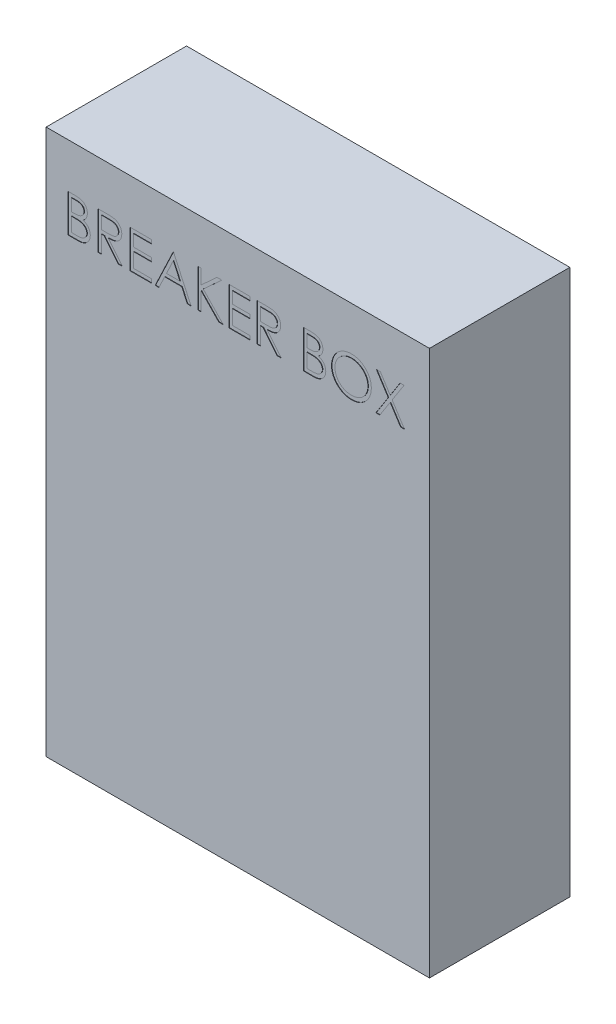
from build123d import *

# Parameters (mm, degrees)
SKETCH1_W           = 225.425
SKETCH1_H           = 320.675
BOSS_EXTRUDE1_DEPTH = 82.55
CUT_EXTRUDE1_DEPTH  = 0.254


with BuildPart() as part:
    # Sketch1 → Boss-Extrude1 (new body)
    with BuildSketch(Plane.XY):
        with Locations((112.7125, -160.3375)):
            Rectangle(SKETCH1_W, SKETCH1_H)
    extrude(amount=-BOSS_EXTRUDE1_DEPTH)

    # Sketch2 → Cut-Extrude1 (cut)
    # profile 1 of 10: a face of its own
    with BuildSketch(Plane.XY):
        with BuildLine():
            Line((12.849427249, -26.324185299), (17.185795438, -26.324185299))
            add(Edge.make_bspline(
                [(17.185795438, -26.324185299), (17.398066274, -26.325301314), (17.809499985, -26.327464429), (18.407793441, -26.361012311), (18.968173388, -26.406755615), (19.490802343, -26.479336703), (19.975438803, -26.566914488), (20.423543299, -26.67297102), (20.833690893, -26.800140017), (21.323356769, -27.002363903), (21.881652966, -27.302866022), (22.48616276, -27.746912411), (23.003079679, -28.290043552), (23.448762794, -28.902708413), (23.803099904, -29.576670564), (24.059444941, -30.295866413), (24.22173745, -31.051019474), (24.238428007, -31.569453654), (24.246863146, -31.831461941)],
                knots=[0, 0, 0, 0, 1.001505555, 1.941167018, 2.826882275, 3.653841531, 4.429895133, 5.150066043, 5.825578002, 6.45369114, 7.647487171, 8.808567382, 9.977351308, 11.170798116, 12.373658725, 13.556498008, 14.765093433, 16, 16, 16, 16], degree=3))
            add(Edge.make_bspline(
                [(24.246863146, -31.831461941), (24.239921209, -32.07690567), (24.226279648, -32.559225743), (24.095833126, -33.264673337), (23.891612882, -33.936193576), (23.607734549, -34.571335724), (23.238786874, -35.155749167), (22.80153655, -35.694148307), (22.273998854, -36.163737519), (21.87875428, -36.42626495), (21.677987946, -36.559616989)],
                knots=[0, 0, 0, 0, 1.044552857, 2.05264487, 3.044412934, 4.028983338, 5.005914585, 5.980388656, 6.974128949, 8, 8, 8, 8], degree=3))
            add(Edge.make_bspline(
                [(21.677987946, -36.559616989), (21.930466661, -36.656549733), (22.413520987, -36.842006083), (23.078277166, -37.169891279), (23.651014432, -37.52652068), (24.136136309, -37.915977928), (24.551030417, -38.335768877), (24.913316596, -38.792048852), (25.222443322, -39.290769965), (25.487320387, -39.826732414), (25.694004988, -40.394463488), (25.84879198, -40.988637917), (25.937485282, -41.607125092), (25.950106805, -42.028037251), (25.956478531, -42.240526444)],
                knots=[0, 0, 0, 0, 1.27268992, 2.434971085, 3.483601985, 4.442670788, 5.356604649, 6.2567628, 7.179492994, 8.113709626, 9.066344395, 10.018646069, 10.999752585, 12, 12, 12, 12], degree=3))
            add(Edge.make_bspline(
                [(25.956478531, -42.240526444), (25.950275559, -42.457486082), (25.938071037, -42.884360248), (25.848028216, -43.511455353), (25.695570387, -44.110736264), (25.485568607, -44.686079174), (25.211487909, -45.236371028), (24.877935336, -45.762235254), (24.480224907, -46.258388254), (24.035325689, -46.73034326), (23.532011065, -47.15469971), (22.988986021, -47.532624447), (22.39941189, -47.843431942), (21.772971728, -48.104518678), (21.102638321, -48.303954389), (20.391421764, -48.443480233), (19.639935447, -48.537492218), (19.124253528, -48.545221469), (18.859793835, -48.549185299)],
                knots=[0, 0, 0, 0, 0.978564426, 1.925352924, 2.850884081, 3.763762016, 4.682927383, 5.618979971, 6.567305752, 7.547517671, 8.540179244, 9.531824382, 10.526200242, 11.540722885, 12.589160233, 13.674978461, 14.80764778, 16, 16, 16, 16], degree=3))
            Line((18.859793835, -48.549185299), (12.849427249, -48.549185299))
            Line((12.849427249, -48.549185299), (12.849427249, -26.324185299))
        make_face()
        with BuildLine():
            Line((14.843978531, -28.603672478), (14.843978531, -35.727069914))
            Line((14.843978531, -35.727069914), (16.184067673, -35.727069914))
            add(Edge.make_bspline(
                [(16.184067673, -35.727069914), (16.379957524, -35.724530403), (16.758456635, -35.71962355), (17.306587978, -35.705567717), (17.815381844, -35.666210141), (18.283959984, -35.626863877), (18.711584503, -35.562890245), (19.097308024, -35.486740265), (19.447184114, -35.406203817), (19.850660228, -35.269237576), (20.308323451, -35.066814338), (20.796213663, -34.752668179), (21.226327544, -34.378498536), (21.589529686, -33.946755929), (21.886782524, -33.471355649), (22.093244616, -32.959882958), (22.23324487, -32.425085119), (22.245891094, -32.057939214), (22.252311864, -31.871531052)],
                knots=[0, 0, 0, 0, 1.156816544, 2.235205308, 3.236616184, 4.169592532, 5.011045266, 5.787822928, 6.49130361, 7.128639758, 8.301311294, 9.436451833, 10.541879658, 11.654887649, 12.756523258, 13.837046038, 14.901820046, 16, 16, 16, 16], degree=3))
            add(Edge.make_bspline(
                [(22.252311864, -31.871531052), (22.24897062, -31.748177403), (22.242416405, -31.50620575), (22.188737933, -31.153467351), (22.097503835, -30.821719523), (21.980319073, -30.506415922), (21.8165609, -30.217415673), (21.623752908, -29.94472638), (21.390798775, -29.697634428), (21.125639839, -29.466688114), (20.820785084, -29.261935362), (20.476416381, -29.082606516), (20.087874632, -28.938202584), (19.661708003, -28.811735016), (19.191356597, -28.72290935), (18.682248183, -28.648910338), (18.130212717, -28.611237427), (17.748291316, -28.606250372), (17.550869556, -28.603672478)],
                knots=[0, 0, 0, 0, 0.91205012, 1.789085906, 2.630437955, 3.453916878, 4.269457761, 5.079663411, 5.91843418, 6.774407191, 7.675494373, 8.627863946, 9.638891023, 10.736472738, 11.911756761, 13.175263542, 14.539845004, 16, 16, 16, 16], degree=3))
            Line((17.550869556, -28.603672478), (14.843978531, -28.603672478))
        make_face(mode=Mode.SUBTRACT)
        with BuildLine():
            Line((14.843978531, -38.006557094), (14.843978531, -46.269698119))
            Line((14.843978531, -46.269698119), (17.684433258, -46.269698119))
            add(Edge.make_bspline(
                [(17.684433258, -46.269698119), (17.887753438, -46.267261323), (18.27962628, -46.26256472), (18.845419091, -46.247232299), (19.3698218, -46.212356348), (19.850441462, -46.157455203), (20.292467836, -46.09790205), (20.690598251, -46.017820417), (21.048060029, -45.926069517), (21.462551883, -45.784247524), (21.929299161, -45.563924933), (22.432288099, -45.231729595), (22.879494584, -44.835976591), (23.25925798, -44.377945286), (23.570490457, -43.87990636), (23.796902597, -43.351933388), (23.936544537, -42.802750289), (23.953449312, -42.428311664), (23.961927249, -42.240526444)],
                knots=[0, 0, 0, 0, 1.160039823, 2.235823828, 3.228722157, 4.157150951, 4.99529583, 5.772374946, 6.472645482, 7.099169577, 8.269452708, 9.405989375, 10.527446681, 11.663510218, 12.788923519, 13.866172445, 14.929861265, 16, 16, 16, 16], degree=3))
            add(Edge.make_bspline(
                [(23.961927249, -42.240526444), (23.960173986, -42.123093732), (23.956695741, -41.890122508), (23.904240837, -41.547757056), (23.827952763, -41.216122761), (23.729328158, -40.894319108), (23.585694542, -40.588164169), (23.418012981, -40.291602916), (23.221408081, -40.004243321), (22.915057628, -39.640945512), (22.469465526, -39.22237248), (21.836327502, -38.81255934), (21.11641341, -38.482055765), (20.59426883, -38.341724091), (20.324542433, -38.269232374)],
                knots=[0, 0, 0, 0, 0.723448775, 1.435228256, 2.130040452, 2.821711965, 3.505591119, 4.210454504, 4.921174351, 5.648778258, 7.137944449, 8.670945889, 10.280296675, 12, 12, 12, 12], degree=3))
            add(Edge.make_bspline(
                [(20.324542433, -38.269232374), (20.216407674, -38.247292591), (19.981949213, -38.199722616), (19.599631077, -38.149508699), (19.16315831, -38.104772569), (18.671523039, -38.071681718), (18.124103248, -38.037477166), (17.519729815, -38.024175052), (16.860870867, -38.00830475), (16.403719302, -38.007154548), (16.16625918, -38.006557094)],
                knots=[0, 0, 0, 0, 0.634451884, 1.375622551, 2.216452059, 3.157844607, 4.20941857, 5.370758133, 6.634282058, 8, 8, 8, 8], degree=3))
            Line((16.16625918, -38.006557094), (14.843978531, -38.006557094))
        make_face(mode=Mode.SUBTRACT)
    # profile 2 of 10: a face of its own
    with BuildSketch(Plane.XY):
        with BuildLine():
            Line((30.51545289, -26.324185299), (34.963124164, -26.324185299))
            add(Edge.make_bspline(
                [(34.963124164, -26.324185299), (35.25993033, -26.32517327), (35.829831047, -26.327070283), (36.646271314, -26.337647878), (37.38812338, -26.367965037), (38.054999359, -26.394054542), (38.646887018, -26.441628369), (39.165601315, -26.487098478), (39.608753194, -26.546621224), (39.87701435, -26.60190066), (39.998475726, -26.62692969)],
                knots=[0, 0, 0, 0, 1.410062039, 2.707475311, 3.878576406, 4.937260626, 5.877586885, 6.699081471, 7.410979367, 8, 8, 8, 8], degree=3))
            add(Edge.make_bspline(
                [(39.998475726, -26.62692969), (40.16107779, -26.66710465), (40.482813173, -26.746597529), (40.946046092, -26.914615994), (41.387462049, -27.109050611), (41.805227434, -27.337420235), (42.197249708, -27.601420085), (42.567570981, -27.896492663), (42.917871674, -28.22102342), (43.233985025, -28.583194663), (43.532048004, -28.9631565), (43.783435782, -29.374025356), (44.000138928, -29.803676055), (44.172671711, -30.256478158), (44.311596843, -30.728040409), (44.409553463, -31.222634269), (44.468298504, -31.73800646), (44.474279287, -32.089529181), (44.477311864, -32.267770034)],
                knots=[0, 0, 0, 0, 1.027469482, 2.033020251, 3.019912614, 3.986113645, 4.951240523, 5.91722682, 6.890402269, 7.87763091, 8.8651537, 9.85103654, 10.82876324, 11.815024772, 12.821070561, 13.842952187, 14.906261191, 16, 16, 16, 16], degree=3))
            add(Edge.make_bspline(
                [(44.477311864, -32.267770034), (44.467983726, -32.563902948), (44.449782113, -33.141734965), (44.280077705, -33.980321562), (44.002096804, -34.762573709), (43.619043919, -35.48750646), (43.131240248, -36.140989058), (42.544977825, -36.714968449), (41.859929592, -37.195281894), (41.222203436, -37.528357204), (40.658868267, -37.741672174), (40.195106731, -37.891763053), (39.689221424, -38.007726532), (39.146059349, -38.111613369), (38.563360137, -38.190046629), (37.942520387, -38.247492503), (37.283097324, -38.283395713), (36.830094234, -38.288742444), (36.597053451, -38.291492991)],
                knots=[0, 0, 0, 0, 1.260483769, 2.459530307, 3.627416485, 4.787058657, 5.939039949, 7.08810263, 8.267026773, 9.491475466, 10.141966685, 10.831826277, 11.566392101, 12.351337768, 13.187381173, 14.07005841, 15.007169909, 16, 16, 16, 16], degree=3))
            Line((36.597053451, -38.291492991), (44.762247762, -48.549185299))
            Line((44.762247762, -48.549185299), (42.295771399, -48.549185299))
            Line((42.295771399, -48.549185299), (34.130577088, -38.291492991))
            Line((34.130577088, -38.291492991), (32.510004172, -38.291492991))
            Line((32.510004172, -38.291492991), (32.510004172, -48.549185299))
            Line((32.510004172, -48.549185299), (30.51545289, -48.549185299))
            Line((30.51545289, -48.549185299), (30.51545289, -26.324185299))
        make_face()
        with BuildLine():
            Line((32.510004172, -28.603672478), (32.510004172, -36.012005811))
            Line((32.510004172, -36.012005811), (36.579244957, -36.043170675))
            add(Edge.make_bspline(
                [(36.579244957, -36.043170675), (36.769237204, -36.043254728), (37.137496292, -36.043417646), (37.670265513, -36.018057167), (38.166328223, -35.989207096), (38.623786999, -35.945078752), (39.042846202, -35.888207697), (39.423296376, -35.817068747), (39.765758556, -35.734188149), (40.165164275, -35.605907825), (40.611166249, -35.402669609), (41.095871019, -35.106978692), (41.508635864, -34.735064786), (41.857364289, -34.30978334), (42.137586179, -33.84219316), (42.335147724, -33.337899215), (42.460512233, -32.809632568), (42.475298497, -32.446551583), (42.482760582, -32.263317911)],
                knots=[0, 0, 0, 0, 1.146690395, 2.22261258, 3.21895312, 4.145990853, 4.996080663, 5.770904154, 6.481378293, 7.121626537, 8.300444488, 9.431385265, 10.535395872, 11.636531494, 12.74115979, 13.810798291, 14.895190096, 16, 16, 16, 16], degree=3))
            add(Edge.make_bspline(
                [(42.482760582, -32.263317911), (42.475127113, -32.084587168), (42.460000363, -31.730408052), (42.336500683, -31.211893022), (42.127653111, -30.722517888), (41.846206901, -30.264273409), (41.503312267, -29.848311986), (41.101244156, -29.492412564), (40.650996167, -29.198728463), (40.230174057, -29.011058147), (39.854036808, -28.895997079), (39.527458467, -28.815027189), (39.158450583, -28.749974811), (38.745221421, -28.697853625), (38.289535065, -28.653054729), (37.789087431, -28.622880934), (37.247198876, -28.605012897), (36.871615863, -28.604129683), (36.677191672, -28.603672478)],
                knots=[0, 0, 0, 0, 1.101028733, 2.181837193, 3.264309656, 4.369019818, 5.486613113, 6.575447106, 7.666700264, 8.788928104, 9.402425223, 10.0903467, 10.862060571, 11.710948788, 12.657782767, 13.684531032, 14.801375019, 16, 16, 16, 16], degree=3))
            Line((36.677191672, -28.603672478), (32.510004172, -28.603672478))
        make_face(mode=Mode.SUBTRACT)
    # profile 3 of 10: a face of its own
    with BuildSketch(Plane.XY):
        Polygon((49.321222121, -26.324185299), (61.858401608, -26.324185299), (61.858401608, -28.603672478), (51.315773403, -28.603672478), (51.315773403, -35.442134017), (61.858401608, -35.442134017), (61.858401608, -37.721621196), (51.315773403, -37.721621196), (51.315773403, -46.269698119), (61.858401608, -46.269698119), (61.858401608, -48.549185299), (49.321222121, -48.549185299), align=None)
    # profile 4 of 10: a face of its own
    with BuildSketch(Plane.XY):
        Polygon((74.96545289, -26.324185299), (85.223145197, -48.549185299), (83.054961103, -48.549185299), (79.769294036, -41.425787863), (69.694138787, -41.425787863), (66.314977129, -48.549185299), (64.137888787, -48.549185299), (74.680516992, -26.324185299), align=None)
        Polygon((74.800724324, -30.656101364), (70.776004773, -39.146300683), (78.718592914, -39.146300683), align=None, mode=Mode.SUBTRACT)
    # profile 5 of 10: a face of its own
    with BuildSketch(Plane.XY):
        Polygon((89.212247762, -26.324185299), (91.206799044, -26.324185299), (91.206799044, -34.787671877), (100.471667834, -26.324185299), (103.316574685, -26.324185299), (92.395515991, -36.296941709), (104.171382377, -48.549185299), (101.513464709, -48.549185299), (91.206799044, -37.824020034), (91.206799044, -48.549185299), (89.212247762, -48.549185299), align=None)
    # profile 6 of 10: a face of its own
    with BuildSketch(Plane.XY):
        Polygon((107.448145197, -26.324185299), (119.985324685, -26.324185299), (119.985324685, -28.603672478), (109.44269648, -28.603672478), (109.44269648, -35.442134017), (119.985324685, -35.442134017), (119.985324685, -37.721621196), (109.44269648, -37.721621196), (109.44269648, -46.269698119), (119.985324685, -46.269698119), (119.985324685, -48.549185299), (107.448145197, -48.549185299), align=None)
    # profile 7 of 10: a face of its own
    with BuildSketch(Plane.XY):
        with BuildLine():
            Line((123.974427249, -26.324185299), (128.422098523, -26.324185299))
            add(Edge.make_bspline(
                [(128.422098523, -26.324185299), (128.718904689, -26.32517327), (129.288805406, -26.327070283), (130.105245673, -26.337647878), (130.847097739, -26.367965037), (131.513973718, -26.394054542), (132.105861377, -26.441628369), (132.624575674, -26.487098478), (133.067727553, -26.546621224), (133.335988709, -26.60190066), (133.457450085, -26.62692969)],
                knots=[0, 0, 0, 0, 1.410062039, 2.707475311, 3.878576406, 4.937260626, 5.877586885, 6.699081471, 7.410979367, 8, 8, 8, 8], degree=3))
            add(Edge.make_bspline(
                [(133.457450085, -26.62692969), (133.620052149, -26.66710465), (133.941787532, -26.746597529), (134.405020451, -26.914615994), (134.846436408, -27.109050611), (135.264201793, -27.337420235), (135.656224067, -27.601420085), (136.02654534, -27.896492663), (136.376846033, -28.22102342), (136.692959384, -28.583194663), (136.991022363, -28.9631565), (137.242410141, -29.374025356), (137.459113287, -29.803676055), (137.63164607, -30.256478158), (137.770571202, -30.728040409), (137.868527822, -31.222634269), (137.927272863, -31.73800646), (137.933253646, -32.089529181), (137.936286223, -32.267770034)],
                knots=[0, 0, 0, 0, 1.027469482, 2.033020251, 3.019912614, 3.986113645, 4.951240523, 5.91722682, 6.890402269, 7.87763091, 8.8651537, 9.85103654, 10.82876324, 11.815024772, 12.821070561, 13.842952187, 14.906261191, 16, 16, 16, 16], degree=3))
            add(Edge.make_bspline(
                [(137.936286223, -32.267770034), (137.926958085, -32.563902948), (137.908756472, -33.141734965), (137.739052063, -33.980321562), (137.461071163, -34.762573709), (137.078018278, -35.48750646), (136.590214607, -36.140989058), (136.003952184, -36.714968449), (135.318903951, -37.195281894), (134.681177795, -37.528357204), (134.117842626, -37.741672174), (133.65408109, -37.891763053), (133.148195783, -38.007726532), (132.605033708, -38.111613369), (132.022334496, -38.190046629), (131.401494746, -38.247492503), (130.742071683, -38.283395713), (130.289068593, -38.288742444), (130.05602781, -38.291492991)],
                knots=[0, 0, 0, 0, 1.260483769, 2.459530307, 3.627416485, 4.787058657, 5.939039949, 7.08810263, 8.267026773, 9.491475466, 10.141966685, 10.831826277, 11.566392101, 12.351337768, 13.187381173, 14.07005841, 15.007169909, 16, 16, 16, 16], degree=3))
            Line((130.05602781, -38.291492991), (138.221222121, -48.549185299))
            Line((138.221222121, -48.549185299), (135.754745758, -48.549185299))
            Line((135.754745758, -48.549185299), (127.589551447, -38.291492991))
            Line((127.589551447, -38.291492991), (125.968978531, -38.291492991))
            Line((125.968978531, -38.291492991), (125.968978531, -48.549185299))
            Line((125.968978531, -48.549185299), (123.974427249, -48.549185299))
            Line((123.974427249, -48.549185299), (123.974427249, -26.324185299))
        make_face()
        with BuildLine():
            Line((125.968978531, -28.603672478), (125.968978531, -36.012005811))
            Line((125.968978531, -36.012005811), (130.038219316, -36.043170675))
            add(Edge.make_bspline(
                [(130.038219316, -36.043170675), (130.228211563, -36.043254728), (130.596470651, -36.043417646), (131.129239872, -36.018057167), (131.625302582, -35.989207096), (132.082761358, -35.945078752), (132.501820561, -35.888207697), (132.882270735, -35.817068747), (133.224732915, -35.734188149), (133.624138634, -35.605907825), (134.070140608, -35.402669609), (134.554845378, -35.106978692), (134.967610223, -34.735064786), (135.316338648, -34.30978334), (135.596560538, -33.84219316), (135.794122083, -33.337899215), (135.919486592, -32.809632568), (135.934272855, -32.446551583), (135.941734941, -32.263317911)],
                knots=[0, 0, 0, 0, 1.146690395, 2.22261258, 3.21895312, 4.145990853, 4.996080663, 5.770904154, 6.481378293, 7.121626537, 8.300444488, 9.431385265, 10.535395872, 11.636531494, 12.74115979, 13.810798291, 14.895190096, 16, 16, 16, 16], degree=3))
            add(Edge.make_bspline(
                [(135.941734941, -32.263317911), (135.934101472, -32.084587168), (135.918974722, -31.730408052), (135.795475042, -31.211893022), (135.58662747, -30.722517888), (135.30518126, -30.264273409), (134.962286626, -29.848311986), (134.560218515, -29.492412564), (134.109970526, -29.198728463), (133.689148416, -29.011058147), (133.313011167, -28.895997079), (132.986432826, -28.815027189), (132.617424942, -28.749974811), (132.20419578, -28.697853625), (131.748509424, -28.653054729), (131.24806179, -28.622880934), (130.706173235, -28.605012897), (130.330590222, -28.604129683), (130.136166031, -28.603672478)],
                knots=[0, 0, 0, 0, 1.101028733, 2.181837193, 3.264309656, 4.369019818, 5.486613113, 6.575447106, 7.666700264, 8.788928104, 9.402425223, 10.0903467, 10.862060571, 11.710948788, 12.657782767, 13.684531032, 14.801375019, 16, 16, 16, 16], degree=3))
            Line((130.136166031, -28.603672478), (125.968978531, -28.603672478))
        make_face(mode=Mode.SUBTRACT)
    # profile 8 of 10: a face of its own
    with BuildSketch(Plane.XY):
        with BuildLine():
            Line((151.328273403, -26.324185299), (155.664641592, -26.324185299))
            add(Edge.make_bspline(
                [(155.664641592, -26.324185299), (155.876912428, -26.325301314), (156.288346139, -26.327464429), (156.886639594, -26.361012311), (157.447019542, -26.406755615), (157.969648496, -26.479336703), (158.454284957, -26.566914488), (158.902389453, -26.67297102), (159.312537047, -26.800140017), (159.802202923, -27.002363903), (160.36049912, -27.302866022), (160.965008913, -27.746912411), (161.481925833, -28.290043552), (161.927608948, -28.902708413), (162.281946057, -29.576670564), (162.538291095, -30.295866413), (162.700583604, -31.051019474), (162.717274161, -31.569453654), (162.7257093, -31.831461941)],
                knots=[0, 0, 0, 0, 1.001505555, 1.941167018, 2.826882275, 3.653841531, 4.429895133, 5.150066043, 5.825578002, 6.45369114, 7.647487171, 8.808567382, 9.977351308, 11.170798116, 12.373658725, 13.556498008, 14.765093433, 16, 16, 16, 16], degree=3))
            add(Edge.make_bspline(
                [(162.7257093, -31.831461941), (162.718767363, -32.07690567), (162.705125802, -32.559225743), (162.57467928, -33.264673337), (162.370459035, -33.936193576), (162.086580703, -34.571335724), (161.717633027, -35.155749167), (161.280382704, -35.694148307), (160.752845008, -36.163737519), (160.357600434, -36.42626495), (160.1568341, -36.559616989)],
                knots=[0, 0, 0, 0, 1.044552857, 2.05264487, 3.044412934, 4.028983338, 5.005914585, 5.980388656, 6.974128949, 8, 8, 8, 8], degree=3))
            add(Edge.make_bspline(
                [(160.1568341, -36.559616989), (160.409312815, -36.656549733), (160.892367141, -36.842006083), (161.55712332, -37.169891279), (162.129860585, -37.52652068), (162.614982462, -37.915977928), (163.029876571, -38.335768877), (163.39216275, -38.792048852), (163.701289476, -39.290769965), (163.966166541, -39.826732414), (164.172851142, -40.394463488), (164.327638134, -40.988637917), (164.416331436, -41.607125092), (164.428952958, -42.028037251), (164.435324685, -42.240526444)],
                knots=[0, 0, 0, 0, 1.27268992, 2.434971085, 3.483601985, 4.442670788, 5.356604649, 6.2567628, 7.179492994, 8.113709626, 9.066344395, 10.018646069, 10.999752585, 12, 12, 12, 12], degree=3))
            add(Edge.make_bspline(
                [(164.435324685, -42.240526444), (164.429121712, -42.457486082), (164.416917191, -42.884360248), (164.32687437, -43.511455353), (164.17441654, -44.110736264), (163.964414761, -44.686079174), (163.690334063, -45.236371028), (163.35678149, -45.762235254), (162.959071061, -46.258388254), (162.514171843, -46.73034326), (162.010857219, -47.15469971), (161.467832175, -47.532624447), (160.878258044, -47.843431942), (160.251817882, -48.104518678), (159.581484475, -48.303954389), (158.870267918, -48.443480233), (158.118781601, -48.537492218), (157.603099682, -48.545221469), (157.338639989, -48.549185299)],
                knots=[0, 0, 0, 0, 0.978564426, 1.925352924, 2.850884081, 3.763762016, 4.682927383, 5.618979971, 6.567305752, 7.547517671, 8.540179244, 9.531824382, 10.526200242, 11.540722885, 12.589160233, 13.674978461, 14.80764778, 16, 16, 16, 16], degree=3))
            Line((157.338639989, -48.549185299), (151.328273403, -48.549185299))
            Line((151.328273403, -48.549185299), (151.328273403, -26.324185299))
        make_face()
        with BuildLine():
            Line((153.322824685, -28.603672478), (153.322824685, -35.727069914))
            Line((153.322824685, -35.727069914), (154.662913827, -35.727069914))
            add(Edge.make_bspline(
                [(154.662913827, -35.727069914), (154.858803678, -35.724530403), (155.237302789, -35.71962355), (155.785434132, -35.705567717), (156.294227998, -35.666210141), (156.762806138, -35.626863877), (157.190430657, -35.562890245), (157.576154178, -35.486740265), (157.926030268, -35.406203817), (158.329506382, -35.269237576), (158.787169605, -35.066814338), (159.275059816, -34.752668179), (159.705173698, -34.378498536), (160.06837584, -33.946755929), (160.365628678, -33.471355649), (160.572090769, -32.959882958), (160.712091024, -32.425085119), (160.724737248, -32.057939214), (160.731158018, -31.871531052)],
                knots=[0, 0, 0, 0, 1.156816544, 2.235205308, 3.236616184, 4.169592532, 5.011045266, 5.787822928, 6.49130361, 7.128639758, 8.301311294, 9.436451833, 10.541879658, 11.654887649, 12.756523258, 13.837046038, 14.901820046, 16, 16, 16, 16], degree=3))
            add(Edge.make_bspline(
                [(160.731158018, -31.871531052), (160.727816774, -31.748177403), (160.721262559, -31.50620575), (160.667584087, -31.153467351), (160.576349989, -30.821719523), (160.459165227, -30.506415922), (160.295407054, -30.217415673), (160.102599062, -29.94472638), (159.869644929, -29.697634428), (159.604485993, -29.466688114), (159.299631238, -29.261935362), (158.955262535, -29.082606516), (158.566720786, -28.938202584), (158.140554157, -28.811735016), (157.670202751, -28.72290935), (157.161094337, -28.648910338), (156.609058871, -28.611237427), (156.22713747, -28.606250372), (156.02971571, -28.603672478)],
                knots=[0, 0, 0, 0, 0.91205012, 1.789085906, 2.630437955, 3.453916878, 4.269457761, 5.079663411, 5.91843418, 6.774407191, 7.675494373, 8.627863946, 9.638891023, 10.736472738, 11.911756761, 13.175263542, 14.539845004, 16, 16, 16, 16], degree=3))
            Line((156.02971571, -28.603672478), (153.322824685, -28.603672478))
        make_face(mode=Mode.SUBTRACT)
        with BuildLine():
            Line((153.322824685, -38.006557094), (153.322824685, -46.269698119))
            Line((153.322824685, -46.269698119), (156.163279412, -46.269698119))
            add(Edge.make_bspline(
                [(156.163279412, -46.269698119), (156.366599592, -46.267261323), (156.758472434, -46.26256472), (157.324265245, -46.247232299), (157.848667954, -46.212356348), (158.329287616, -46.157455203), (158.77131399, -46.09790205), (159.169444404, -46.017820417), (159.526906183, -45.926069517), (159.941398037, -45.784247524), (160.408145315, -45.563924933), (160.911134253, -45.231729595), (161.358340738, -44.835976591), (161.738104134, -44.377945286), (162.049336611, -43.87990636), (162.275748751, -43.351933388), (162.415390691, -42.802750289), (162.432295466, -42.428311664), (162.440773403, -42.240526444)],
                knots=[0, 0, 0, 0, 1.160039823, 2.235823828, 3.228722157, 4.157150951, 4.99529583, 5.772374946, 6.472645482, 7.099169577, 8.269452708, 9.405989375, 10.527446681, 11.663510218, 12.788923519, 13.866172445, 14.929861265, 16, 16, 16, 16], degree=3))
            add(Edge.make_bspline(
                [(162.440773403, -42.240526444), (162.43902014, -42.123093732), (162.435541895, -41.890122508), (162.38308699, -41.547757056), (162.306798917, -41.216122761), (162.208174312, -40.894319108), (162.064540696, -40.588164169), (161.896859135, -40.291602916), (161.700254235, -40.004243321), (161.393903782, -39.640945512), (160.94831168, -39.22237248), (160.315173656, -38.81255934), (159.595259564, -38.482055765), (159.073114984, -38.341724091), (158.803388587, -38.269232374)],
                knots=[0, 0, 0, 0, 0.723448775, 1.435228256, 2.130040452, 2.821711965, 3.505591119, 4.210454504, 4.921174351, 5.648778258, 7.137944449, 8.670945889, 10.280296675, 12, 12, 12, 12], degree=3))
            add(Edge.make_bspline(
                [(158.803388587, -38.269232374), (158.695253828, -38.247292591), (158.460795367, -38.199722616), (158.078477231, -38.149508699), (157.642004464, -38.104772569), (157.150369193, -38.071681718), (156.602949402, -38.037477166), (155.998575968, -38.024175052), (155.33971702, -38.00830475), (154.882565456, -38.007154548), (154.645105334, -38.006557094)],
                knots=[0, 0, 0, 0, 0.634451884, 1.375622551, 2.216452059, 3.157844607, 4.20941857, 5.370758133, 6.634282058, 8, 8, 8, 8], degree=3))
            Line((154.645105334, -38.006557094), (153.322824685, -38.006557094))
        make_face(mode=Mode.SUBTRACT)
    # profile 9 of 10: a face of its own
    with BuildSketch(Plane.XY):
        with BuildLine():
            add(Edge.make_bspline(
                [(179.3944593, -25.754313504), (179.805990773, -25.764736898), (180.614272538, -25.785209304), (181.802198138, -25.941921611), (182.936276993, -26.213037337), (184.025747375, -26.574117276), (185.057577776, -27.055792623), (186.039534743, -27.637993315), (186.969281892, -28.326818828), (187.834287665, -29.116944419), (188.625859299, -29.976629351), (189.323253677, -30.89406408), (189.907722242, -31.863701475), (190.387691991, -32.882627749), (190.764238162, -33.948538546), (191.02407409, -35.067116463), (191.190051343, -36.231113945), (191.20945553, -37.025034536), (191.219299044, -37.427781052)],
                knots=[0, 0, 0, 0, 1.065120563, 2.091984664, 3.0946048, 4.079830382, 5.057816894, 6.036188127, 7.030412546, 8.04752943, 9.064399622, 10.05169764, 11.02544977, 11.989514704, 12.962713494, 13.945757189, 14.957906945, 16, 16, 16, 16], degree=3))
            add(Edge.make_bspline(
                [(191.219299044, -37.427781052), (191.209456972, -37.827560836), (191.190057109, -38.615573106), (191.023885372, -39.772183976), (190.763275022, -40.884009899), (190.391188731, -41.949194794), (189.913506943, -42.968862324), (189.325146607, -43.940329481), (188.632099918, -44.863914746), (187.843386414, -45.72950017), (186.983589797, -46.523234109), (186.061377603, -47.21486897), (185.097490022, -47.810017161), (184.079523375, -48.284893491), (183.020978141, -48.664445185), (181.912380389, -48.923224386), (180.758924771, -49.090147111), (179.972343897, -49.109314687), (179.572544236, -49.119057094)],
                knots=[0, 0, 0, 0, 1.043624062, 2.057103931, 3.04512605, 4.022047818, 4.998200453, 5.980619268, 6.982898556, 8.009068085, 9.034988726, 10.034168286, 11.015286542, 11.987931943, 12.962482838, 13.94673481, 14.956375938, 16, 16, 16, 16], degree=3))
            add(Edge.make_bspline(
                [(179.572544236, -49.119057094), (179.16979981, -49.109218487), (178.375883339, -49.089823975), (177.210423165, -48.923572054), (176.091059491, -48.663594775), (175.020993361, -48.292059855), (173.999628058, -47.81189044), (173.024966033, -47.226392633), (172.100919448, -46.531657286), (171.235149358, -45.743199538), (170.442991949, -44.884860182), (169.752369914, -43.965162663), (169.166740444, -43.002150513), (168.688183283, -41.993151235), (168.309313966, -40.943042574), (168.050838371, -39.844819742), (167.883605075, -38.70474388), (167.8643338, -37.928501475), (167.854555454, -37.534632013)],
                knots=[0, 0, 0, 0, 1.053102029, 2.075944431, 3.073151272, 4.055350789, 5.033113405, 6.020478099, 7.024410459, 8.052272461, 9.079885166, 10.07527673, 11.055994387, 12.023226415, 12.992069828, 13.970394897, 14.97016774, 16, 16, 16, 16], degree=3))
            add(Edge.make_bspline(
                [(167.854555454, -37.534632013), (167.857950389, -37.270264564), (167.864697432, -36.74486478), (167.945924679, -35.964661869), (168.063791481, -35.197006192), (168.232713626, -34.444080673), (168.453640712, -33.70772842), (168.714321085, -32.982871076), (169.032709103, -32.27685443), (169.392631219, -31.586333893), (169.794343699, -30.922073691), (170.238054708, -30.294188338), (170.708179298, -29.697409008), (171.223566848, -29.147200534), (171.767231275, -28.627556816), (172.347991976, -28.146463563), (172.962305228, -27.699582624), (173.612814339, -27.296863458), (174.283490385, -26.932632953), (174.974857924, -26.6200742), (175.677527153, -26.351811709), (176.394789167, -26.134382469), (177.12473927, -25.96272904), (177.868970602, -25.845842344), (178.626890259, -25.764407926), (179.137502134, -25.757692788), (179.3944593, -25.754313504)],
                knots=[0, 0, 0, 0, 1.037015668, 2.060948919, 3.074880161, 4.083647147, 5.086022904, 6.090072063, 7.104153813, 8.122640571, 9.144368836, 10.147691507, 11.138137339, 12.123020368, 13.103399296, 14.087645067, 15.080126199, 16.082011238, 17.087798457, 18.072939717, 19.057185487, 20.037253025, 21.01195951, 21.997135196, 22.992090687, 24, 24, 24, 24], degree=3))
        make_face()
        with BuildLine():
            add(Edge.make_bspline(
                [(179.492406015, -28.033800683), (179.281493092, -28.036371736), (178.861683588, -28.041489263), (178.237576782, -28.108899057), (177.621678003, -28.204973852), (177.013860053, -28.342016509), (176.416666115, -28.528732244), (175.824529624, -28.743622011), (175.242850232, -29.005375936), (174.673548234, -29.301112609), (174.121637507, -29.628448256), (173.600856853, -29.990218977), (173.109858064, -30.377940796), (172.649843321, -30.792518564), (172.222163377, -31.236063535), (171.818400523, -31.701851504), (171.45473868, -32.203196012), (171.121455267, -32.726502096), (170.823209481, -33.271088137), (170.557999478, -33.831220762), (170.341058023, -34.411469073), (170.164131933, -35.005537974), (170.017448134, -35.612486593), (169.924522716, -36.236919233), (169.856372234, -36.875698194), (169.851547215, -37.307382967), (169.849106736, -37.525727767)],
                knots=[0, 0, 0, 0, 1.008559885, 2.007477868, 2.99961109, 3.989939068, 4.984837346, 5.991145699, 7.001802488, 8.033829008, 9.059044045, 10.069351652, 11.065060232, 12.050310815, 13.029377138, 14.011219647, 14.996725999, 15.989392538, 16.977580475, 17.965360261, 18.951710183, 19.937753436, 20.929683414, 21.935841486, 22.955955122, 24, 24, 24, 24], degree=3))
            add(Edge.make_bspline(
                [(169.849106736, -37.525727767), (169.857202109, -37.846797869), (169.873128213, -38.478442086), (170.012558784, -39.4040698), (170.227328321, -40.293630418), (170.543922598, -41.142256542), (170.939849001, -41.957242738), (171.428969754, -42.731359203), (172.008464948, -43.464815155), (172.666728342, -44.152490113), (173.386327529, -44.78016097), (174.150440364, -45.331108615), (174.950880771, -45.797263701), (175.789736108, -46.177025911), (176.662527981, -46.477950746), (177.57488043, -46.684190053), (178.520715849, -46.819924195), (179.165435509, -46.832959195), (179.492406015, -46.839569914)],
                knots=[0, 0, 0, 0, 1.032063989, 2.030389145, 3.003944642, 3.970395727, 4.937377036, 5.913328081, 6.909231446, 7.93887556, 8.970685674, 9.976071282, 10.964166581, 11.944589148, 12.933237628, 13.927779006, 14.949070134, 16, 16, 16, 16], degree=3))
            add(Edge.make_bspline(
                [(179.492406015, -46.839569914), (179.71217635, -46.836550461), (180.148046931, -46.83056198), (180.796353498, -46.770245382), (181.432980442, -46.673523011), (182.05703482, -46.534263348), (182.667808372, -46.359973587), (183.267850372, -46.152914514), (183.850769515, -45.894588871), (184.423919485, -45.609169379), (184.97253562, -45.283794378), (185.49625525, -44.934302128), (185.981877722, -44.547151386), (186.441548326, -44.138733277), (186.870984151, -43.700812843), (187.267281201, -43.233959434), (187.62910504, -42.735226261), (187.962261896, -42.212713934), (188.259462614, -41.66663773), (188.518409893, -41.104474275), (188.738095229, -40.52760783), (188.915441234, -39.935206351), (189.054413916, -39.328394962), (189.150171408, -38.706361165), (189.217153993, -38.07034934), (189.222202733, -37.640175855), (189.224747762, -37.423328928)],
                knots=[0, 0, 0, 0, 1.047197238, 2.076906641, 3.100256066, 4.114471768, 5.12198147, 6.126382909, 7.136867548, 8.15857795, 9.17633901, 10.174870724, 11.156907918, 12.133735059, 13.104061851, 14.077631395, 15.04955518, 16.038496417, 17.029181396, 18.010275684, 18.986308667, 19.968651475, 20.955262928, 21.950658345, 22.966943676, 24, 24, 24, 24], degree=3))
            add(Edge.make_bspline(
                [(189.224747762, -37.423328928), (189.222200694, -37.207965476), (189.217148117, -36.780752398), (189.150203403, -36.149176201), (189.054312749, -35.531618308), (188.916119553, -34.930503159), (188.738001077, -34.345677525), (188.518371529, -33.777690677), (188.259384877, -33.224426638), (187.962152652, -32.687252852), (187.628042173, -32.171793266), (187.262953728, -31.679017947), (186.860583768, -31.218181039), (186.43242851, -30.777905732), (185.967793388, -30.367582133), (185.46878312, -29.987074127), (184.941455767, -29.627198835), (184.383117822, -29.302551518), (183.806893715, -29.00274114), (183.215620082, -28.74587727), (182.6159953, -28.527614312), (182.009544186, -28.341451584), (181.391162274, -28.205510592), (180.765027961, -28.108812476), (180.132007519, -28.041512725), (179.706283074, -28.036379522), (179.492406015, -28.033800683)],
                knots=[0, 0, 0, 0, 1.02996197, 2.043119294, 3.035359645, 4.018872909, 4.991431989, 5.957985074, 6.929999688, 7.912076566, 8.892894881, 9.867085534, 10.843653904, 11.817741046, 12.803660682, 13.806313499, 14.818574707, 15.856120519, 16.894564902, 17.924820532, 18.937903209, 19.946497019, 20.957711757, 21.963978472, 22.977135795, 24, 24, 24, 24], degree=3))
        make_face(mode=Mode.SUBTRACT)
    # profile 10 of 10: a face of its own
    with BuildSketch(Plane.XY):
        Polygon((194.211125967, -26.324185299), (196.512873763, -26.324185299), (202.331799044, -35.415421276), (208.150724324, -26.324185299), (210.452472121, -26.324185299), (203.484899004, -37.214079129), (210.737408018, -48.549185299), (208.435660222, -48.549185299), (202.331799044, -39.012736981), (196.227937866, -48.549185299), (193.926190069, -48.549185299), (201.183151207, -37.214079129), align=None)
    extrude(amount=-CUT_EXTRUDE1_DEPTH, mode=Mode.SUBTRACT)


solid = part.part
